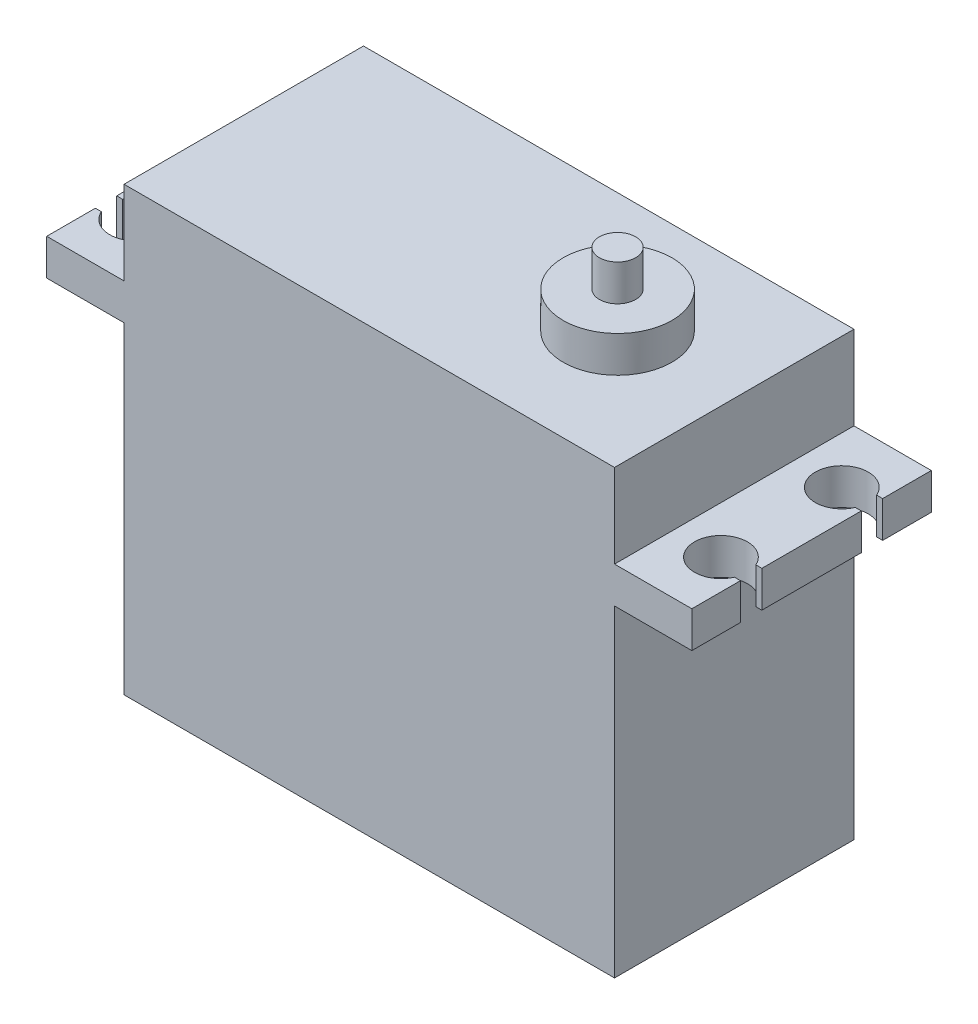
from build123d import *

# Parameters (mm, degrees)
ESQUISSE2_W        = 40.6
ESQUISSE2_H        = 19.82
BOSS_EXTRU_1_DEPTH = 36.6
ESQUISSE5_R        = 1.5
BOSS_EXTRU_2_DEPTH = 6
BOSS_EXTRU_3_DEPTH = 3
ESQUISSE5_3_R      = 4.5
ESQUISSE5_3_R_2    = 1.5
BOSS_EXTRU_4_DEPTH = 3


with BuildPart() as part:
    # Esquisse2 → Boss.-Extru.1 (new body)
    with BuildSketch(Plane(origin=(0, 0, 0), x_dir=(1, 0, 0), z_dir=(0, 1, 0))):
        with Locations((-26.090639329, -15.529787325)):
            Rectangle(ESQUISSE2_W, ESQUISSE2_H)
    extrude(amount=BOSS_EXTRU_1_DEPTH)

    # Esquisse5 → Boss.-Extru.2 (add)
    with BuildSketch(Plane(origin=(0, 36.6, 0), x_dir=(1, 0, 0), z_dir=(0, 1, 0))):
        with Locations((-15.450639329, -15.529787325)):
            Circle(ESQUISSE5_R)
    extrude(amount=BOSS_EXTRU_2_DEPTH)

    # Esquisse12 → Boss.-Extru.3 (add)
    with BuildSketch(Plane(origin=(0, 26.67, 0), x_dir=(-1, 0, 0), z_dir=(0, -1, 0))):
        with BuildLine():
            Line((46.390639329, -25.439787325), (52.790639329, -25.439787325))
            Line((52.790639329, -25.439787325), (52.790639329, -21.414567223))
            Line((52.790639329, -21.414567223), (52.293952717, -21.414567223))
            ThreePointArc((52.293952717, -21.414567223), (48.100639329, -20.529787325), (52.293952717, -19.645007427))
            Line((52.293952717, -19.645007427), (52.790639329, -19.645007427))
            Line((52.790639329, -19.645007427), (52.790639329, -11.414567223))
            Line((52.790639329, -11.414567223), (52.293952717, -11.414567223))
            ThreePointArc((52.293952717, -11.414567223), (48.100639329, -10.529787325), (52.293952717, -9.645007427))
            Line((52.293952717, -9.645007427), (52.790639329, -9.645007427))
            Line((52.790639329, -9.645007427), (52.790639329, -5.619787325))
            Line((52.790639329, -5.619787325), (46.390639329, -5.619787325))
            Line((46.390639329, -5.619787325), (46.390639329, -25.439787325))
        make_face()
        with BuildLine():
            Line((5.790639329, -25.439787325), (5.790639329, -5.619787325))
            Line((5.790639329, -5.619787325), (-0.609360671, -5.619787325))
            Line((-0.609360671, -5.619787325), (-0.609360671, -9.645007427))
            Line((-0.609360671, -9.645007427), (-0.112674059, -9.645007427))
            ThreePointArc((-0.112674059, -9.645007427), (4.080639329, -10.529787325), (-0.112674059, -11.414567223))
            Line((-0.112674059, -11.414567223), (-0.609360671, -11.414567223))
            Line((-0.609360671, -11.414567223), (-0.609360671, -19.645007427))
            Line((-0.609360671, -19.645007427), (-0.112674059, -19.645007427))
            ThreePointArc((-0.112674059, -19.645007427), (4.080639329, -20.529787325), (-0.112674059, -21.414567223))
            Line((-0.112674059, -21.414567223), (-0.609360671, -21.414567223))
            Line((-0.609360671, -21.414567223), (-0.609360671, -25.439787325))
            Line((-0.609360671, -25.439787325), (5.790639329, -25.439787325))
        make_face()
    extrude(amount=-BOSS_EXTRU_3_DEPTH)

    # Esquisse5<3> → Boss.-Extru.4 (add)
    with BuildSketch(Plane(origin=(0, 36.6, 0), x_dir=(1, 0, 0), z_dir=(0, 1, 0))):
        with Locations((-15.450639329, -15.529787325)):
            Circle(ESQUISSE5_3_R)
        with Locations((-15.450639329, -15.529787325)):
            Circle(ESQUISSE5_3_R_2, mode=Mode.SUBTRACT)
    extrude(amount=BOSS_EXTRU_4_DEPTH)


solid = part.part
